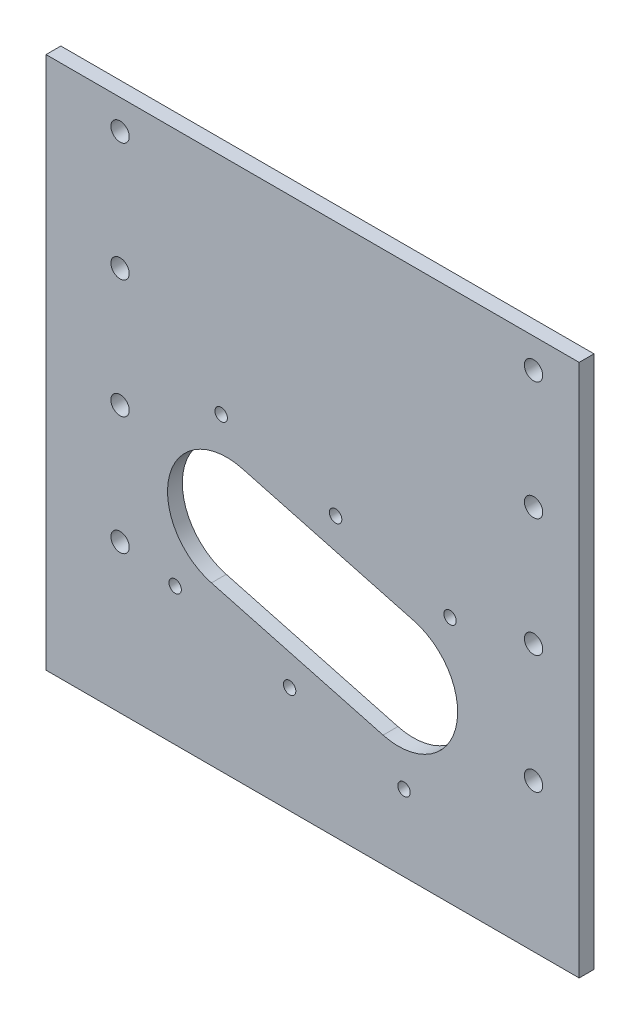
from build123d import *

# Parameters (mm, degrees)
SKETCH1_W           = 180
SKETCH1_H           = 180
BOSS_EXTRUDE1_DEPTH = 5
CUT_EXTRUDE1_DEPTH  = 128.377392029
SKETCH4_R           = 3.1
CUT_EXTRUDE2_DEPTH  = 128.377392029
SKETCH5_R           = 3.1
CUT_EXTRUDE3_DEPTH  = 128.377392029
SKETCH6_R           = 2.1
CUT_EXTRUDE4_DEPTH  = 128.377392029


with BuildPart() as part:
    # Sketch1 → Boss-Extrude1 (new body)
    with BuildSketch(Plane.XY):
        Rectangle(SKETCH1_W, SKETCH1_H)
    extrude(amount=BOSS_EXTRUDE1_DEPTH)

    # Sketch3 → Cut-Extrude1 (cut, through all)
    with BuildSketch(Plane(origin=(0, 0, 0), x_dir=(-1, 0, 0), z_dir=(0, 0, -1))):
        with BuildLine():
            Line((-34.154155691, -13.446054827), (23.801393887, 2.083087879))
            ThreePointArc((23.801393887, 2.083087879), (48.296291314, -12.059047745), (34.154155691, -36.553945173))
            Line((34.154155691, -36.553945173), (-23.801393887, -52.083087879))
            ThreePointArc((-23.801393887, -52.083087879), (-48.296291314, -37.940952255), (-34.154155691, -13.446054827))
        make_face()
    extrude(amount=-CUT_EXTRUDE1_DEPTH, mode=Mode.SUBTRACT)

    # Sketch4 → Cut-Extrude2 (cut, through all)
    with BuildSketch(Plane.XY.offset(5)):
        with Locations((-65, 80)):
            Circle(SKETCH4_R)
        with Locations((-65, 40)):
            Circle(SKETCH4_R)
        with Locations((-65, 0)):
            Circle(SKETCH4_R)
        with Locations((-65, -40)):
            Circle(SKETCH4_R)
    extrude(amount=-CUT_EXTRUDE2_DEPTH, mode=Mode.SUBTRACT)

    # Sketch5 → Cut-Extrude3 (cut, through all)
    with BuildSketch(Plane(origin=(0, 0, 0), x_dir=(-1, 0, 0), z_dir=(0, 0, -1))):
        with Locations((-74.600409008, 80)):
            Circle(SKETCH5_R)
        with Locations((-74.600409008, 40)):
            Circle(SKETCH5_R)
        with Locations((-74.600409008, 0)):
            Circle(SKETCH5_R)
        with Locations((-74.600409008, -40)):
            Circle(SKETCH5_R)
    extrude(amount=-CUT_EXTRUDE3_DEPTH, mode=Mode.SUBTRACT)

    # Sketch6 → Cut-Extrude4 (cut, through all)
    with BuildSketch(Plane(origin=(0, 0, 0), x_dir=(-1, 0, 0), z_dir=(0, 0, -1))):
        with Locations((-7.764571353, 3.977774789)):
            Circle(SKETCH6_R)
        with Locations(Location((7.764571353, -53.977774789, 0), (0, 0, 180))):
            Circle(SKETCH6_R)
        with Locations(Location((46.401604405, -43.625012985, 0), (0, 0, 180))):
            Circle(SKETCH6_R)
        with Locations((30.872461698, 14.330536593)):
            Circle(SKETCH6_R)
        with Locations((-30.872461698, -64.330536593)):
            Circle(SKETCH6_R)
        with Locations(Location((-46.401604405, -6.374987015, 0), (0, 0, 180))):
            Circle(SKETCH6_R)
    extrude(amount=-CUT_EXTRUDE4_DEPTH, mode=Mode.SUBTRACT)


solid = part.part
